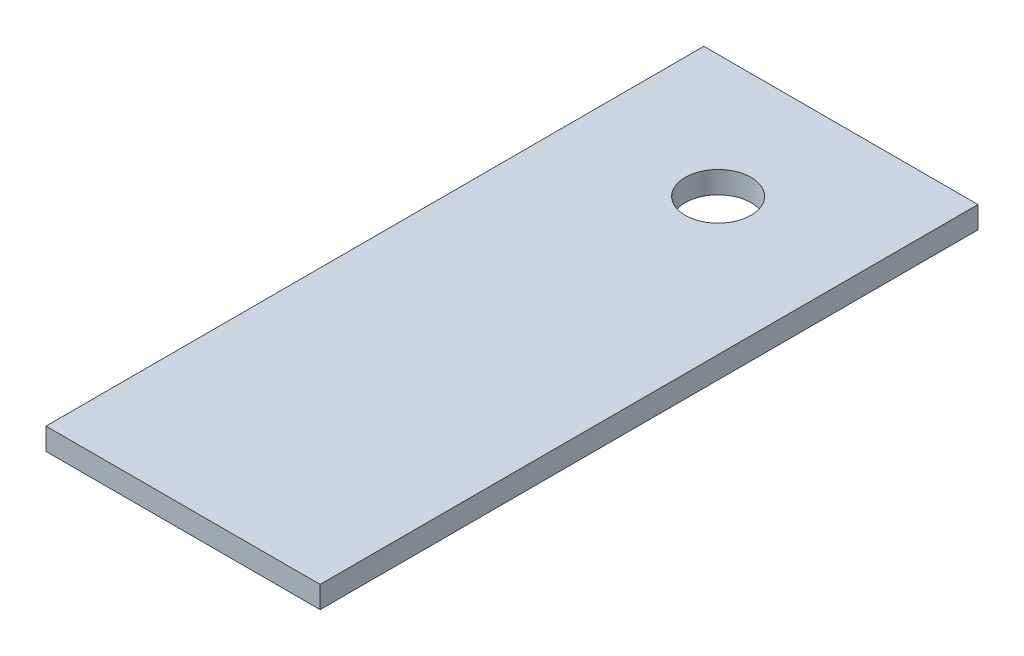
from build123d import *

# Parameters (mm, degrees)
SKETCH_1_W      = 25
SKETCH_1_H      = 60
SKETCH_1_R      = 3
EXTRUDE_1_DEPTH = 2


with BuildPart() as part:
    # ｽｹｯﾁ1 → ﾎﾞｽ - 押し出し1 (new body)
    with BuildSketch(Plane(origin=(0, 0, 0), x_dir=(1, 0, 0), z_dir=(0, 1, 0))):
        Rectangle(SKETCH_1_W, SKETCH_1_H)
        with Locations(Location((0, 18.8, 0), (0, 0, 270))):
            Circle(SKETCH_1_R, mode=Mode.SUBTRACT)
    extrude(amount=EXTRUDE_1_DEPTH)


solid = part.part
